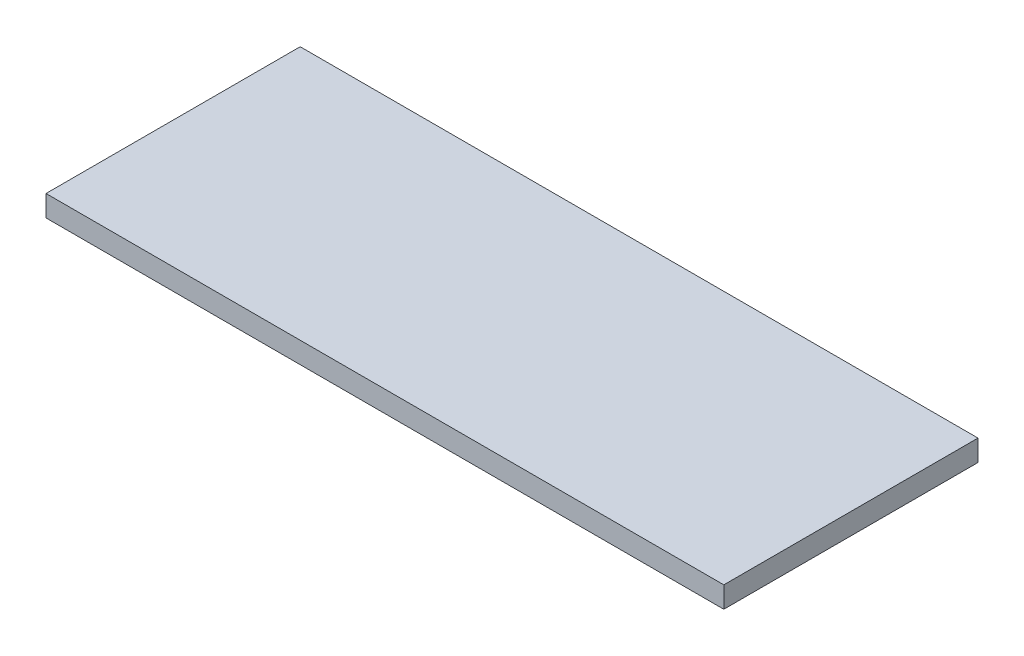
from build123d import *

# Parameters (mm, degrees)
SKETCH1_W           = 609.6
SKETCH1_H           = 228.6
BOSS_EXTRUDE1_DEPTH = 19.05


with BuildPart() as part:
    # Sketch1 → Boss-Extrude1 (new body)
    with BuildSketch(Plane(origin=(0, 0, 0), x_dir=(1, 0, 0), z_dir=(0, 1, 0))):
        with Locations((304.8, 114.3)):
            Rectangle(SKETCH1_W, SKETCH1_H)
    extrude(amount=BOSS_EXTRUDE1_DEPTH)


solid = part.part
